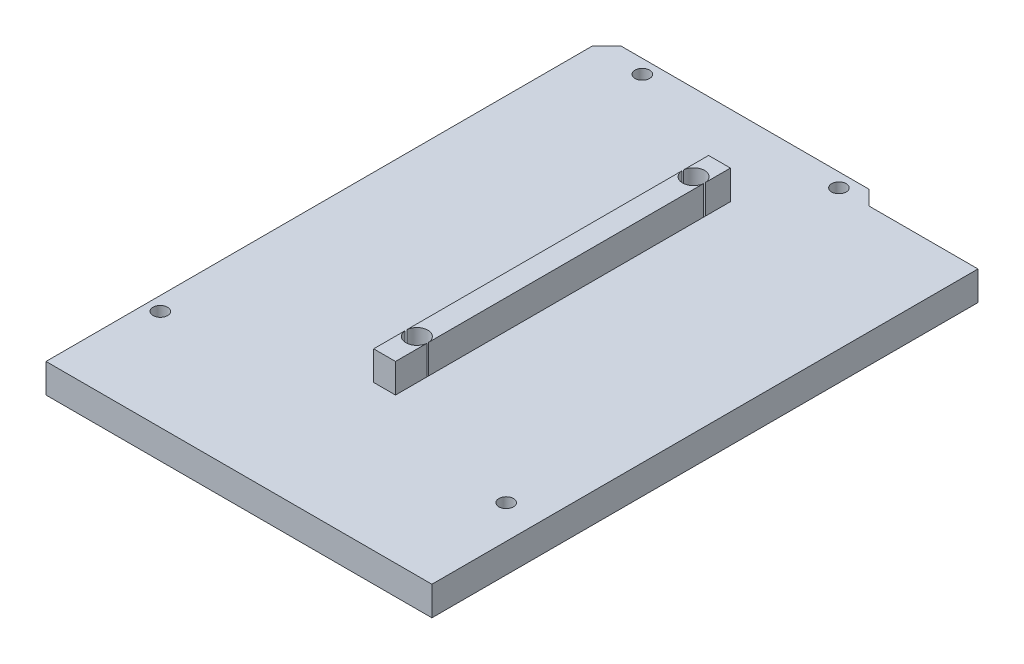
from build123d import *

# Parameters (mm, degrees)
SKETCH_1_R          = 1
EXTRUDE_2_DEPTH     = 4
SKETCH_3_W          = 3
SKETCH_3_H          = 46
EXTRUDE_3_DEPTH     = 4
SKETCH_4_R          = 1.505
CUT_EXTRUDE_7_DEPTH = 8
CHAMFER_1_SIZE      = 1.5
CHAMFER_2_SIZE      = 1.5


with BuildPart() as part:
    # Эскиз1 → Бобышка-Вытянуть2 (new body)
    with BuildSketch(Plane(origin=(0, 0, 0), x_dir=(1, 0, 0), z_dir=(0, 1, 0))):
        Polygon((2.396260851, 76.824196235), (36.396260851, 76.824196235), (38.396260851, 74.824196235), (53.396260851, 74.824196235), (53.396260851, -0.175803765), (0.396260851, -0.175803765), (0.396260851, 74.824196235), align=None)
        with Locations(Location((7.196260851, 74.924196235, 0), (0, 0, 270))):
            Circle(SKETCH_1_R, mode=Mode.SUBTRACT)
        with Locations(Location((34.196260851, 74.924196235, 0), (0, 0, 270))):
            Circle(SKETCH_1_R, mode=Mode.SUBTRACT)
        with Locations(Location((2.296260851, 13.624196235, 0), (0, 0, 270))):
            Circle(SKETCH_1_R, mode=Mode.SUBTRACT)
        with Locations(Location((48.796260851, 14.624196235, 0), (0, 0, 270))):
            Circle(SKETCH_1_R, mode=Mode.SUBTRACT)
    extrude(amount=EXTRUDE_2_DEPTH)

    # Эскиз3 → Бобышка-Вытянуть3 (add)
    with BuildSketch(Plane(origin=(0, 4, 0), x_dir=(1, 0, 0), z_dir=(0, 1, 0))):
        with Locations((26.896260851, 42.824196235)):
            Rectangle(SKETCH_3_W, SKETCH_3_H)
    extrude(amount=EXTRUDE_3_DEPTH)

    # Эскиз4 → Вырез-Вытянуть7 (cut)
    with BuildSketch(Plane.XZ):
        with Locations(Location((26.896260851, -24.262976388, 0), (0, 0, 270))):
            Circle(SKETCH_4_R)
        with Locations(Location((26.896260851, -62.262976388, 0), (0, 0, 270))):
            Circle(SKETCH_4_R)
    extrude(amount=-CUT_EXTRUDE_7_DEPTH, mode=Mode.SUBTRACT)

    # Фаска1
    chamfer_1_edges = [part.edges().sort_by_distance(p)[0] for p in [
        (26.896260851, 0, -60.757976388),
    ]]
    chamfer(chamfer_1_edges, length=CHAMFER_1_SIZE)

    # Фаска2
    chamfer_2_edges = [part.edges().sort_by_distance(p)[0] for p in [
        (26.896260851, 0, -22.757976388),
    ]]
    chamfer(chamfer_2_edges, length=CHAMFER_2_SIZE)


solid = part.part
